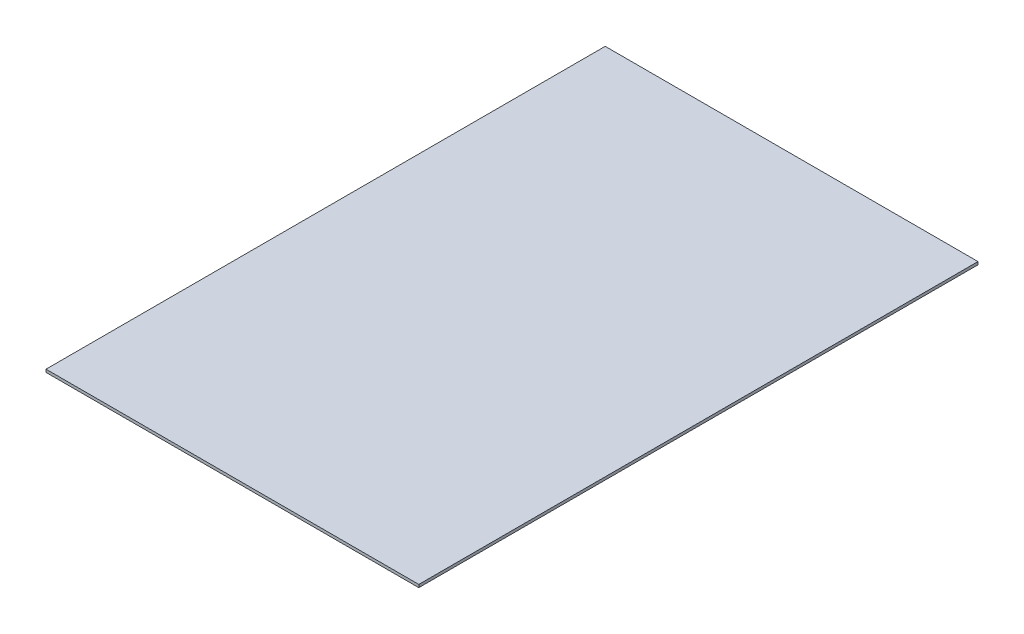
from build123d import *

# Parameters (mm, degrees)
SKETCH1_W           = 200
SKETCH1_H           = 300
BOSS_EXTRUDE1_DEPTH = 1.52


with BuildPart() as part:
    # Sketch1 → Boss-Extrude1 (new body)
    with BuildSketch(Plane(origin=(0, 0, 0), x_dir=(1, 0, 0), z_dir=(0, 1, 0))):
        with Locations((100, 150)):
            Rectangle(SKETCH1_W, SKETCH1_H)
    extrude(amount=BOSS_EXTRUDE1_DEPTH)


solid = part.part
